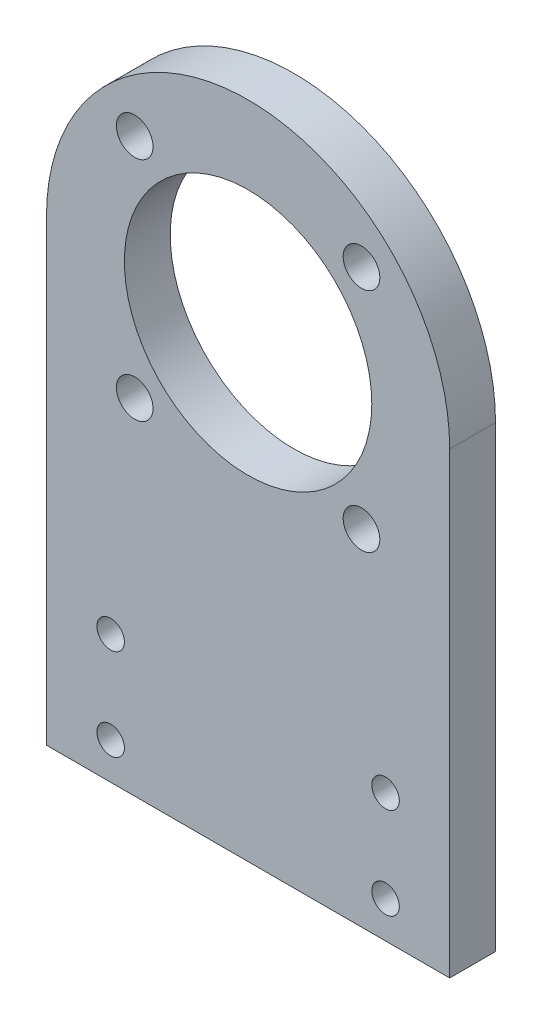
from build123d import *

# Parameters (mm, degrees)
SKETCH_1_R          = 1.5
SKETCH_1_R_2        = 13.5
EXTRUDE_1_DEPTH     = 5
SKETCH_2_R          = 2
CUT_EXTRUDE_1_DEPTH = 76.451971479


with BuildPart() as part:
    # 草图1 → 凸台-拉伸1 (new body)
    with BuildSketch(Plane.XY):
        with BuildLine():
            Line((-22, 0), (22, 0))
            Line((22, 0), (22, 50))
            ThreePointArc((22, 50), (0, 72), (-22, 50))
            Line((-22, 50), (-22, 0))
        make_face()
        with Locations((-15, 14)):
            Circle(SKETCH_1_R, mode=Mode.SUBTRACT)
        with Locations((-15, 4)):
            Circle(SKETCH_1_R, mode=Mode.SUBTRACT)
        with Locations(Location((15, 4, 0), (0, 0, 180))):
            Circle(SKETCH_1_R, mode=Mode.SUBTRACT)
        with Locations(Location((15, 14, 0), (0, 0, 180))):
            Circle(SKETCH_1_R, mode=Mode.SUBTRACT)
        with Locations((0, 50)):
            Circle(SKETCH_1_R_2, mode=Mode.SUBTRACT)
    extrude(amount=EXTRUDE_1_DEPTH)

    # 草图2 → 切除-拉伸1 (cut, through all)
    with BuildSketch(Plane(origin=(0, 0, 0), x_dir=(-1, 0, 0), z_dir=(0, 0, -1))):
        with Locations((12.374368671, 62.374368671)):
            Circle(SKETCH_2_R)
        with Locations((12.374368671, 37.625631329)):
            Circle(SKETCH_2_R)
        with Locations((-12.374368671, 37.625631329)):
            Circle(SKETCH_2_R)
        with Locations((-12.374368671, 62.374368671)):
            Circle(SKETCH_2_R)
    extrude(amount=-CUT_EXTRUDE_1_DEPTH, mode=Mode.SUBTRACT)


solid = part.part
